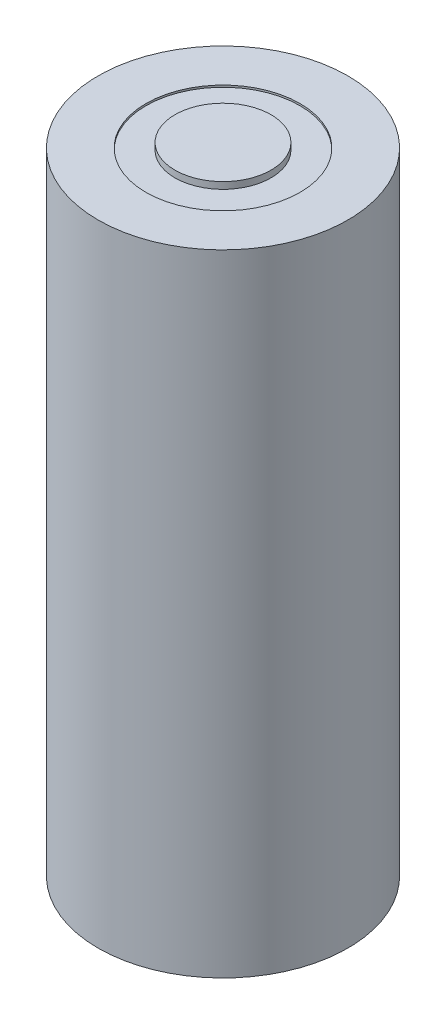
from build123d import *

# Parameters (mm, degrees)
SKETCH_1_R          = 13.05
EXTRUDE_1_DEPTH     = 65.9
SKETCH_2_R          = 10.978194701
CUT_EXTRUDE_1_DEPTH = 0.5
SKETCH_3_R          = 5.021706909
EXTRUDE_2_DEPTH     = 0.5
CUT_EXTRUDE_START   = -0.2
SKETCH_4_R          = 8.048308781
SKETCH_4_R_2        = 5.021706909
CUT_EXTRUDE_2_DEPTH = 0.2


with BuildPart() as part:
    # 草图1 → 凸台-拉伸1 (new body)
    with BuildSketch(Plane(origin=(0, 0, 0), x_dir=(1, 0, 0), z_dir=(0, 1, 0))):
        with Locations(Location((0, 0, 0), (0, 0, 270))):
            Circle(SKETCH_1_R)
    extrude(amount=EXTRUDE_1_DEPTH)

    # 草图2 → 切除-拉伸1 (cut)
    with BuildSketch(Plane.XZ):
        with Locations(Location((0, 0, 0), (0, 0, 270))):
            Circle(SKETCH_2_R)
    extrude(amount=-CUT_EXTRUDE_1_DEPTH, mode=Mode.SUBTRACT)

    # 草图3 → 凸台-拉伸2 (add)
    with BuildSketch(Plane(origin=(0, 65.9, 0), x_dir=(1, 0, 0), z_dir=(0, 1, 0))):
        with Locations(Location((0, 0, 0), (0, 0, 270))):
            Circle(SKETCH_3_R)
    extrude(amount=EXTRUDE_2_DEPTH)

    # 草图4 → 切除-拉伸2 (cut)
    with BuildSketch(Plane(origin=(0, 65.9, 0), x_dir=(1, 0, 0), z_dir=(0, 1, 0)).offset(CUT_EXTRUDE_START)):
        with Locations(Location((0, 0, 0), (0, 0, 270))):
            Circle(SKETCH_4_R)
        with Locations(Location((0, 0, 0), (0, 0, 270))):
            Circle(SKETCH_4_R_2, mode=Mode.SUBTRACT)
    extrude(amount=CUT_EXTRUDE_2_DEPTH, mode=Mode.SUBTRACT)


solid = part.part
